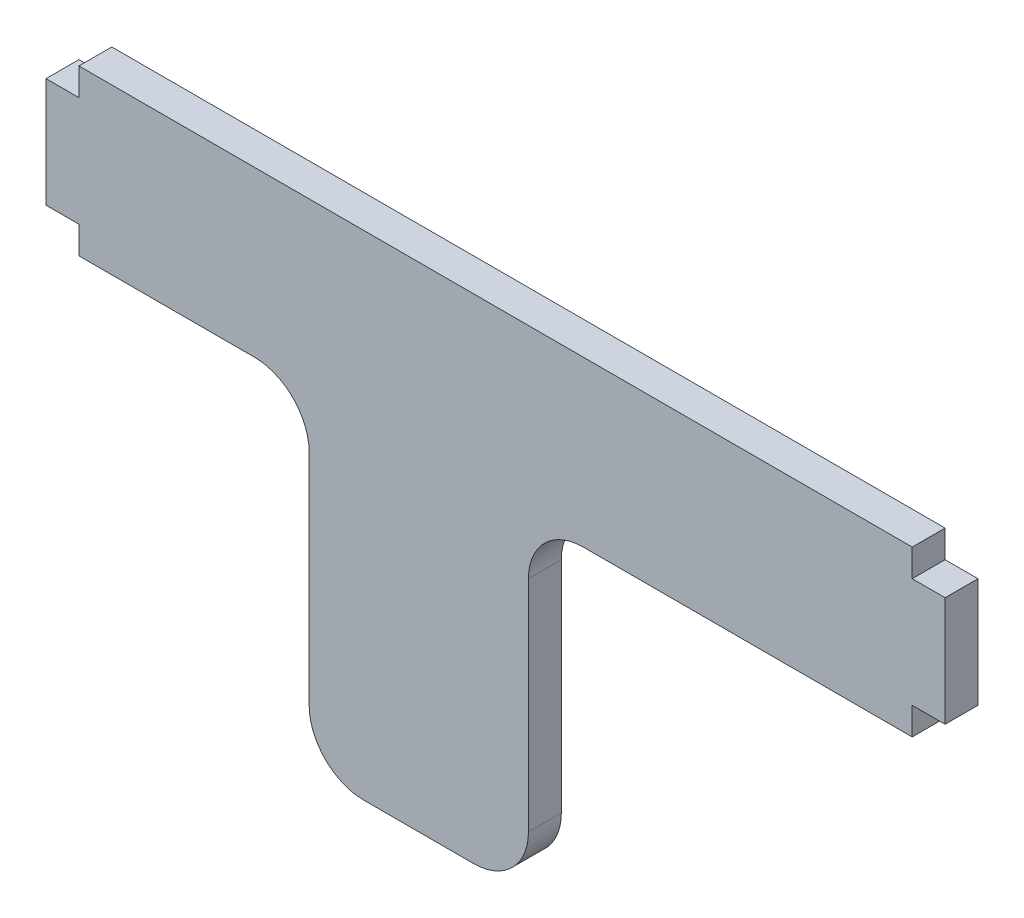
from build123d import *

# Parameters (mm, degrees)
ESBO_O1_W                = 76
ESBO_O1_H                = 15
ESBO_O1_W_2              = 20
ESBO_O1_H_2              = 30
ESBO_O1_W_3              = 3
ESBO_O1_H_3              = 10
RESSALTO_EXTRUS_O1_DEPTH = 3
FILETE1_R                = 5


with BuildPart() as part:
    # Esboço1 → Ressalto-extrusão1 (new body)
    with BuildSketch(Plane.XY):
        Rectangle(ESBO_O1_W, ESBO_O1_H)
        with Locations((-7, -22.5)):
            Rectangle(ESBO_O1_W_2, ESBO_O1_H_2)
        with Locations((39.5, 0)):
            Rectangle(ESBO_O1_W_3, ESBO_O1_H_3)
        with Locations((-39.5, 0)):
            Rectangle(ESBO_O1_W_3, ESBO_O1_H_3)
    extrude(amount=RESSALTO_EXTRUS_O1_DEPTH)

    # Filete1
    filete1_edges = [part.edges().sort_by_distance(p)[0] for p in [
        (3, -7.5, 1.5),
        (3, -37.5, 1.5),
        (-17, -37.5, 1.5),
        (-17, -7.5, 1.5),
    ]]
    fillet(filete1_edges, radius=FILETE1_R)


solid = part.part
